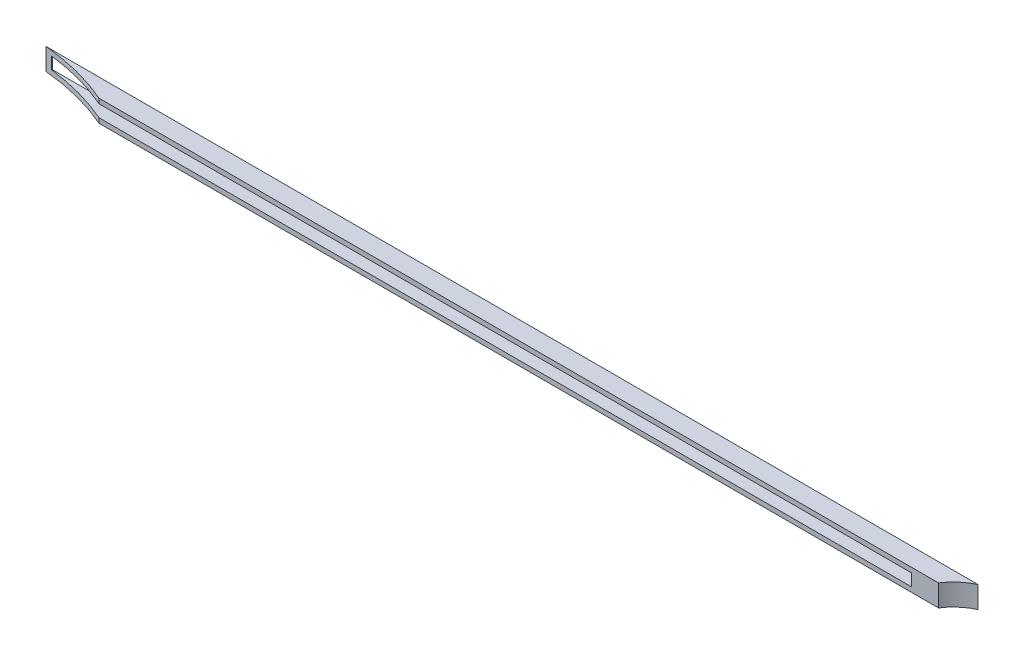
from build123d import *

# Parameters (mm, degrees)
SKETCH1_W               = 512.407402158
SKETCH1_H               = 11.43
SKETCH1_W_2             = 461.607402158
SKETCH1_H_2             = 6.35
BOSS_EXTRUDE1_DEPTH     = 9.652
CUT_EXTRUDE1_DEPTH      = 257.640102966
CUT_EXTRUDE1_DEPTH_BACK = 257.640102966
SKETCH2_R               = 121.331498574
SKETCH2_R_2             = 26.533992322


with BuildPart() as part:
    # Sketch1 → Boss-Extrude1 (new body)
    with BuildSketch(Plane.XY):
        Rectangle(SKETCH1_W, SKETCH1_H)
        Rectangle(SKETCH1_W_2, SKETCH1_H_2, mode=Mode.SUBTRACT)
    extrude(amount=BOSS_EXTRUDE1_DEPTH)

    # Sketch2 → Cut-Extrude1 (cut, two sides: drawn at the far end of the back side and taken through both)
    with BuildSketch(Plane(origin=(0, 5.715, 0), x_dir=(1, 0, 0), z_dir=(0, 1, 0)).offset(-CUT_EXTRUDE1_DEPTH_BACK)):
        with Locations((-245.184147657, -120.830054161)):
            Circle(SKETCH2_R)
        with Locations((267.338172934, -24.084772887)):
            Circle(SKETCH2_R_2)
    extrude(amount=CUT_EXTRUDE1_DEPTH + CUT_EXTRUDE1_DEPTH_BACK, mode=Mode.SUBTRACT)


solid = part.part
